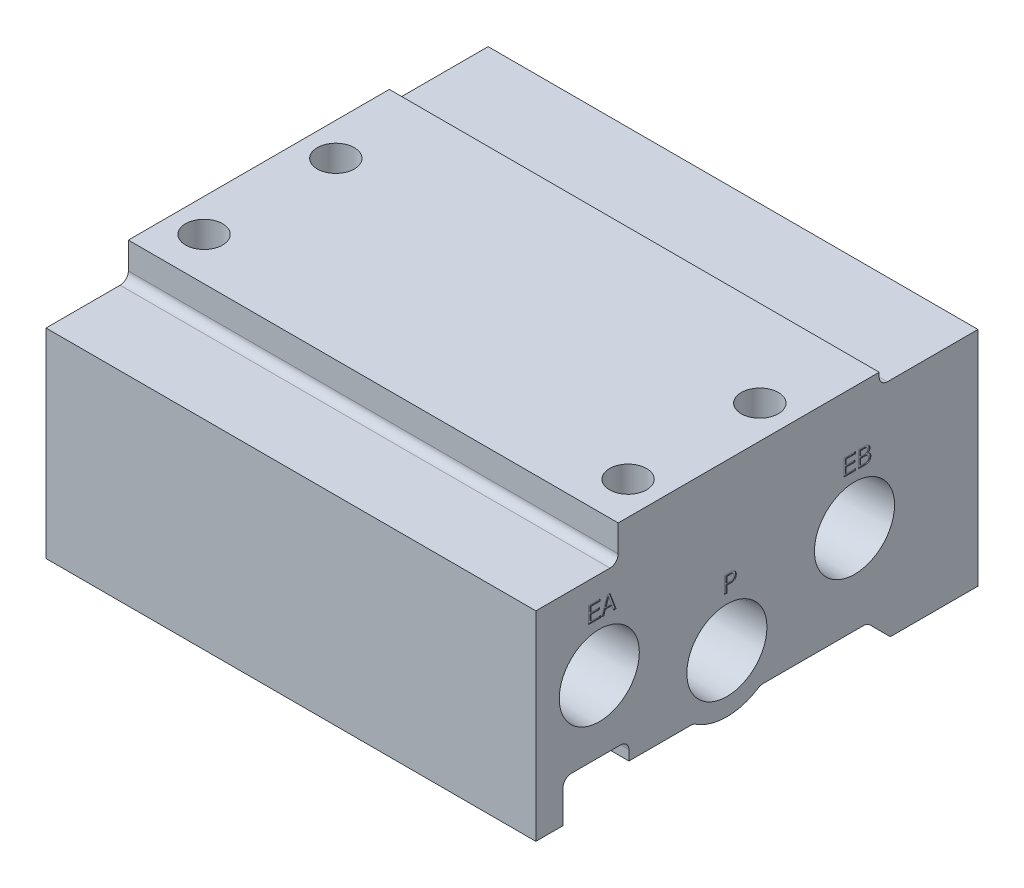
from build123d import *

# Parameters (mm, degrees)
ALUM_EXT_SKETCH_W          = 53.7
ALUM_EXT_SKETCH_H          = 28.5
ALUM_EXT_DEPTH             = 59.5
MGT_HOLES_SKETCH_R         = 2.25
MGT_HOLES_DEPTH            = 72.227961504
TOP_PROFILE_41_SKETCH_W    = 10
TOP_PROFILE_41_SKETCH_H    = 4.25
TOP_PROFILE_41_SKETCH_W_2  = 12
TOP_PROFILE_41_SKETCH_H_2  = 1.5
TOP_PROFILE_41_DEPTH       = 72.227961504
BOTTOM_PROFILE_41_DEPTH    = 72.227961504
ROUNDS_41_R                = 1
PORTS_AT_2_COUNT           = 2
PORTS_AT_2_PITCH           = 16.317475295
PORTS_AT_3_COUNT           = 2
PORTS_AT_3_PITCH           = 16.317475295
PORTS_MIRROR_AT_2_COUNT    = 2
PORTS_MIRROR_AT_2_PITCH    = 16.317475295
PORTS_MIRROR_AT_3_COUNT    = 2
PORTS_MIRROR_AT_3_PITCH    = 31
F_41_42_PORT_LABELS1_DEPTH = 0.1
F_41_42_PORT_LABELS2_DEPTH = 0.1
F_41_42_A_B_LABELS_DEPTH   = 0.1


with BuildPart() as part:
    # Alum Ext Sketch → Alum Ext (new body)
    with BuildSketch(Plane(origin=(0, 0, 0), x_dir=(0, 0, -1), z_dir=(1, 0, 0))):
        with Locations((0, -14.25)):
            Rectangle(ALUM_EXT_SKETCH_W, ALUM_EXT_SKETCH_H)
    extrude(amount=-ALUM_EXT_DEPTH)

    # MGT_Holes Sketch → MGT_Holes (cut, through all)
    with BuildSketch(Plane(origin=(0, 0, 0), x_dir=(1, 0, 0), z_dir=(0, 1, 0))):
        with Locations(Location((-55.5, 4.35, 0), (0, 0, 270))):
            Circle(MGT_HOLES_SKETCH_R)
        with Locations(Location((-55.5, -11.65, 0), (0, 0, 90))):
            Circle(MGT_HOLES_SKETCH_R)
        with Locations(Location((-4, 4.35, 0), (0, 0, 270))):
            Circle(MGT_HOLES_SKETCH_R)
        with Locations(Location((-4, -11.65, 0), (0, 0, 270))):
            Circle(MGT_HOLES_SKETCH_R)
    extrude(amount=-MGT_HOLES_DEPTH, mode=Mode.SUBTRACT)

    # Top_Profile_41 Sketch → Top_Profile_41 (cut, through all)
    with BuildSketch(Plane(origin=(0, 0, 0), x_dir=(0, 0, -1), z_dir=(1, 0, 0))):
        with Locations((-21.85, -2.125)):
            Rectangle(TOP_PROFILE_41_SKETCH_W, TOP_PROFILE_41_SKETCH_H)
        with Locations((20.85, -0.75)):
            Rectangle(TOP_PROFILE_41_SKETCH_W_2, TOP_PROFILE_41_SKETCH_H_2)
    extrude(amount=-TOP_PROFILE_41_DEPTH, mode=Mode.SUBTRACT)

    # Bottom_Profile_41 Sketch → Bottom_Profile_41 (cut, through all)
    with BuildSketch(Plane(origin=(0, 0, 0), x_dir=(0, 0, -1), z_dir=(1, 0, 0))):
        with BuildLine():
            Line((16.2, -28.5), (13.4, -25.7))
            Line((13.4, -25.7), (0.413249931, -25.7))
            ThreePointArc((0.413249931, -25.7), (-3.65, -27), (-7.713249931, -25.7))
            Line((-7.713249931, -25.7), (-15.55, -25.7))
            Line((-15.55, -25.7), (-15.55, -23.5))
            Line((-15.55, -23.5), (-23.55, -23.5))
            Line((-23.55, -23.5), (-23.55, -28.5))
            Line((-23.55, -28.5), (16.2, -28.5))
        make_face()
    extrude(amount=-BOTTOM_PROFILE_41_DEPTH, mode=Mode.SUBTRACT)

    # Rounds_41
    rounds_41_edges = [part.edges().sort_by_distance(p)[0] for p in [
        (-29.75, -4.25, 16.85),
        (-29.75, -1.5, -14.85),
        (-29.75, -25.7, -0.413249931),
        (-29.75, -23.5, 23.55),
        (-29.75, -23.5, 15.55),
        (-29.75, -25.7, 7.713249931),
        (-29.75, -25.7, -13.4),
    ]]
    fillet(rounds_41_edges, radius=ROUNDS_41_R)

    # Ports Profile Sketch → Ports (revolve, cut)
    with BuildSketch(Plane(origin=(0, -20, 3.65), x_dir=(0, 0, -1), z_dir=(0, 1, 0))):
        Polygon((0, 0), (0, 22.45), (3.95, 18.5), (3.95, 7.4), (4.632997004, 7.4), (4.864, 0), align=None)
    ports = revolve(axis=Axis((6.35, -20, 3.65), (-1, 0, 0)), mode=Mode.SUBTRACT)

    # Ports at 2: Ports ×2
    with Locations(*[Vector(0, 0.31254835125081226, -0.9499018518407041) * (i * PORTS_AT_2_PITCH) for i in range(1, PORTS_AT_2_COUNT)]):
        add(ports, mode=Mode.SUBTRACT)

    # Ports at 3: Ports ×2
    with Locations(*[Vector(0, 0.31254835125081226, 0.9499018518407041) * (i * PORTS_AT_3_PITCH) for i in range(1, PORTS_AT_3_COUNT)]):
        add(ports, mode=Mode.SUBTRACT)

    # Ports Mirror Profile Sketch → Ports Mirror (revolve, cut)
    with BuildSketch(Plane(origin=(-59.5, -14.9, -11.85), x_dir=(0, 0, 1), z_dir=(0, 1, 0))):
        Polygon((0, 0), (0, 15.885), (3.95, 11.935), (3.95, 7.4), (4.632997004, 7.4), (4.864, 0), align=None)
    ports_mirror = revolve(axis=Axis((-65.85, -14.9, -11.85), (1, 0, 0)), mode=Mode.SUBTRACT)

    # Ports Mirror at 2: Ports Mirror ×2
    with Locations(*[Vector(0, -0.31254835125081226, 0.9499018518407041) * (i * PORTS_MIRROR_AT_2_PITCH) for i in range(1, PORTS_MIRROR_AT_2_COUNT)]):
        add(ports_mirror, mode=Mode.SUBTRACT)

    # Ports Mirror at 3: Ports Mirror ×2
    with Locations(*[(0, 0, i * PORTS_MIRROR_AT_3_PITCH) for i in range(1, PORTS_MIRROR_AT_3_COUNT)]):
        add(ports_mirror, mode=Mode.SUBTRACT)

    # 41,42 Port Labels1 Sketch → 41,42 Port Labels1 (cut)
    # profile 1 of 5: a face of its own
    with BuildSketch(Plane.ZY.offset(59.5)):
        Polygon((-13.144871795, -8.9), (-13.144871795, -6.9), (-11.731410256, -6.9), (-11.731410256, -7.130769231), (-12.862820513, -7.130769231), (-12.862820513, -7.746153846), (-11.817948718, -7.746153846), (-11.817948718, -7.976923077), (-12.862820513, -7.976923077), (-12.862820513, -8.669230769), (-11.708974359, -8.669230769), (-11.708974359, -8.9), align=None)
    # profile 2 of 5: a face of its own
    with BuildSketch(Plane.ZY.offset(59.5)):
        with BuildLine():
            Line((-11.375641026, -8.9), (-11.375641026, -6.9))
            Line((-11.375641026, -6.9), (-10.582371795, -6.9))
            add(Edge.make_bspline(
                [(-10.582371795, -6.9), (-10.557520601, -6.900391088), (-10.509221677, -6.901151178), (-10.439257463, -6.906808568), (-10.373884128, -6.915794729), (-10.313491954, -6.928977632), (-10.25772712, -6.945607443), (-10.206981233, -6.966644139), (-10.160714162, -6.990826937), (-10.119486132, -7.019131964), (-10.082912178, -7.050918934), (-10.051607199, -7.087006382), (-10.024425363, -7.126312863), (-10.002795087, -7.169699096), (-9.985826511, -7.216613207), (-9.974014126, -7.267309873), (-9.966656438, -7.321659157), (-9.965816477, -7.359110147), (-9.965384615, -7.378365385)],
                knots=[0, 0, 0, 0, 1.338531614, 2.601470082, 3.778553788, 4.890456792, 5.928162005, 6.908738963, 7.84520586, 8.735147048, 9.596633689, 10.447968487, 11.301973765, 12.164180963, 13.051676454, 13.983434255, 14.963192844, 16, 16, 16, 16], degree=3))
            add(Edge.make_bspline(
                [(-9.965384615, -7.378365385), (-9.966331591, -7.402996395), (-9.968168925, -7.450785796), (-9.981718133, -7.519887959), (-10.005663085, -7.582918484), (-10.038410282, -7.640323126), (-10.080645807, -7.691469707), (-10.132507487, -7.735784439), (-10.193110711, -7.77443215), (-10.238424067, -7.793555438), (-10.261858974, -7.803445513)],
                knots=[0, 0, 0, 0, 1.064089938, 2.064560856, 3.027045975, 3.965441717, 4.908263127, 5.877849772, 6.902478258, 8, 8, 8, 8], degree=3))
            add(Edge.make_bspline(
                [(-10.261858974, -7.803445513), (-10.246569522, -7.806518626), (-10.216485798, -7.812565323), (-10.17316555, -7.826052918), (-10.132251748, -7.841956303), (-10.093880076, -7.860736947), (-10.058519403, -7.883036867), (-10.02554128, -7.907811801), (-9.995201163, -7.935720854), (-9.967752142, -7.966578157), (-9.94267115, -7.999705375), (-9.921668464, -8.035541546), (-9.903328698, -8.073092565), (-9.888526343, -8.112963113), (-9.876994446, -8.155075497), (-9.868507088, -8.199259529), (-9.863726514, -8.245513022), (-9.863126284, -8.276992465), (-9.862820513, -8.293028846)],
                knots=[0, 0, 0, 0, 1.079472139, 2.123983387, 3.137357801, 4.117691995, 5.07752268, 6.028353704, 6.970961659, 7.927265266, 8.885490285, 9.843581377, 10.799169054, 11.776706782, 12.784239396, 13.820032524, 14.889472473, 16, 16, 16, 16], degree=3))
            add(Edge.make_bspline(
                [(-9.862820513, -8.293028846), (-9.863272496, -8.315767522), (-9.864153514, -8.360090374), (-9.873541022, -8.424660596), (-9.887061044, -8.485768657), (-9.907353971, -8.543283868), (-9.933566292, -8.597000116), (-9.964872333, -8.647657469), (-10.002489133, -8.694254066), (-10.045355165, -8.737068494), (-10.093055612, -8.775646479), (-10.145401463, -8.808971319), (-10.201906819, -8.836986969), (-10.262136906, -8.860475813), (-10.326816833, -8.877901069), (-10.395416655, -8.890532564), (-10.468116052, -8.898929064), (-10.517977934, -8.899637332), (-10.543509615, -8.9)],
                knots=[0, 0, 0, 0, 1.058427598, 2.063116183, 3.033417234, 3.969927738, 4.896405358, 5.812972495, 6.737861532, 7.679194237, 8.630321786, 9.589794139, 10.563499171, 11.563941868, 12.596215416, 13.678433312, 14.811246201, 16, 16, 16, 16], degree=3))
            Line((-10.543509615, -8.9), (-11.375641026, -8.9))
        make_face()
        with BuildLine():
            Line((-11.093589744, -7.720512821), (-10.638060897, -7.720512821))
            add(Edge.make_bspline(
                [(-10.638060897, -7.720512821), (-10.62189856, -7.72024581), (-10.59060934, -7.719728896), (-10.545208349, -7.716795414), (-10.503095771, -7.710636868), (-10.464283505, -7.702711026), (-10.428663129, -7.693061693), (-10.39684222, -7.679824467), (-10.367793522, -7.665385266), (-10.342235553, -7.64779035), (-10.319629027, -7.628173795), (-10.300015633, -7.605914124), (-10.284162537, -7.580643527), (-10.270210543, -7.55333256), (-10.259923231, -7.523089629), (-10.252860224, -7.490409561), (-10.248348588, -7.45527911), (-10.247747178, -7.430997327), (-10.247435897, -7.418429487)],
                knots=[0, 0, 0, 0, 1.368886017, 2.65007316, 3.849640785, 4.969751217, 6.004381673, 6.968357812, 7.883879336, 8.746530739, 9.588092002, 10.41369514, 11.248159001, 12.107988605, 13.005734059, 13.944160956, 14.935932503, 16, 16, 16, 16], degree=3))
            add(Edge.make_bspline(
                [(-10.247435897, -7.418429487), (-10.24779526, -7.406534873), (-10.248487838, -7.383611119), (-10.252344592, -7.350275069), (-10.259615487, -7.319417291), (-10.2694704, -7.29082689), (-10.28256798, -7.264808482), (-10.298163447, -7.241021057), (-10.316774453, -7.219617856), (-10.338193209, -7.200634591), (-10.362634513, -7.184106045), (-10.389977449, -7.169577213), (-10.420615726, -7.157824898), (-10.454032304, -7.147613488), (-10.490564803, -7.140314754), (-10.529999659, -7.134572338), (-10.572575304, -7.131523238), (-10.60199904, -7.131026383), (-10.617227564, -7.130769231)],
                knots=[0, 0, 0, 0, 1.064043854, 2.05066597, 2.995108535, 3.894129092, 4.74873584, 5.593437176, 6.431611697, 7.277662936, 8.145602371, 9.064553025, 10.040417484, 11.075719197, 12.186014413, 13.368359838, 14.637970495, 16, 16, 16, 16], degree=3))
            Line((-10.617227564, -7.130769231), (-11.093589744, -7.130769231))
            Line((-11.093589744, -7.130769231), (-11.093589744, -7.720512821))
        make_face(mode=Mode.SUBTRACT)
        with BuildLine():
            Line((-11.093589744, -8.669230769), (-10.566746795, -8.669230769))
            add(Edge.make_bspline(
                [(-10.566746795, -8.669230769), (-10.549908372, -8.668922161), (-10.517373227, -8.668325869), (-10.470137599, -8.663774034), (-10.425994956, -8.656854934), (-10.385013028, -8.64634983), (-10.346971081, -8.633180858), (-10.312127837, -8.616877954), (-10.280547117, -8.597345386), (-10.251784041, -8.575352814), (-10.226609275, -8.550046268), (-10.204679995, -8.522071895), (-10.186188284, -8.49137213), (-10.170917321, -8.458069746), (-10.159316799, -8.421991925), (-10.151012013, -8.383343954), (-10.145625468, -8.342058175), (-10.145127121, -8.313612472), (-10.144871795, -8.299038462)],
                knots=[0, 0, 0, 0, 1.261340787, 2.437158505, 3.552412744, 4.605618057, 5.602418951, 6.564726798, 7.481099983, 8.379712099, 9.271165627, 10.147841252, 11.036708081, 11.950072001, 12.886651798, 13.869902527, 14.90865543, 16, 16, 16, 16], degree=3))
            add(Edge.make_bspline(
                [(-10.144871795, -8.299038462), (-10.145117446, -8.284595974), (-10.145594563, -8.256544995), (-10.151054338, -8.215943132), (-10.159140342, -8.17810658), (-10.171288059, -8.143473319), (-10.18652651, -8.111724261), (-10.205588286, -8.083183638), (-10.227647172, -8.057184402), (-10.253710324, -8.034583368), (-10.28331899, -8.01494812), (-10.31638283, -7.997503895), (-10.353598, -7.98333953), (-10.394496601, -7.971081379), (-10.439692519, -7.962804431), (-10.488439021, -7.955798704), (-10.541174333, -7.951838231), (-10.577557944, -7.951471772), (-10.596394231, -7.951282051)],
                knots=[0, 0, 0, 0, 1.058252033, 2.055394168, 2.998523969, 3.890395008, 4.739981298, 5.573732922, 6.40003374, 7.23274972, 8.093659094, 9.000297479, 9.967667442, 11.00874663, 12.12639854, 13.332554366, 14.619027337, 16, 16, 16, 16], degree=3))
            Line((-10.596394231, -7.951282051), (-11.093589744, -7.951282051))
            Line((-11.093589744, -7.951282051), (-11.093589744, -8.669230769))
        make_face(mode=Mode.SUBTRACT)
    # profile 3 of 5: a face of its own
    with BuildSketch(Plane.ZY.offset(59.5)):
        with BuildLine():
            Line((3.355128205, -14), (3.355128205, -12))
            Line((3.355128205, -12), (4.095913462, -12))
            add(Edge.make_bspline(
                [(4.095913462, -12), (4.12409362, -12.000249378), (4.177002091, -12.000717587), (4.250934098, -12.003608091), (4.314154858, -12.009200397), (4.368073681, -12.016451865), (4.415166702, -12.02754219), (4.458606554, -12.040013914), (4.499344903, -12.056098279), (4.524832794, -12.069234093), (4.537419872, -12.075721154)],
                knots=[0, 0, 0, 0, 1.493455121, 2.803973871, 3.919514338, 4.856337602, 5.683863995, 6.481055044, 7.249876038, 8, 8, 8, 8], degree=3))
            add(Edge.make_bspline(
                [(4.537419872, -12.075721154), (4.557109161, -12.087505308), (4.596238242, -12.110924292), (4.646867088, -12.157428597), (4.691435381, -12.210646113), (4.726929673, -12.2725773), (4.756116688, -12.340350372), (4.776198097, -12.414407034), (4.789029685, -12.493809121), (4.790347685, -12.548692188), (4.791025641, -12.576923077)],
                knots=[0, 0, 0, 0, 0.930560885, 1.849329941, 2.778623248, 3.742228717, 4.739438803, 5.770715934, 6.853295292, 8, 8, 8, 8], degree=3))
            add(Edge.make_bspline(
                [(4.791025641, -12.576923077), (4.790347059, -12.603953612), (4.78902587, -12.65658169), (4.776100386, -12.733053307), (4.755916476, -12.804708226), (4.727367087, -12.871331941), (4.690898401, -12.932063622), (4.64652939, -12.986531524), (4.594678687, -13.034755885), (4.555051994, -13.060899771), (4.535016026, -13.07411859)],
                knots=[0, 0, 0, 0, 1.106237948, 2.15382993, 3.166616047, 4.14912887, 5.113446575, 6.058253874, 7.018218259, 8, 8, 8, 8], degree=3))
            add(Edge.make_bspline(
                [(4.535016026, -13.07411859), (4.522597077, -13.081071894), (4.497311506, -13.095229151), (4.456117103, -13.111618603), (4.412179284, -13.125952788), (4.372704814, -13.134789239), (4.337996409, -13.140616309), (4.307779075, -13.144194947), (4.273668896, -13.146691653), (4.235640761, -13.149761537), (4.193551564, -13.151643471), (4.147467197, -13.152726574), (4.097518693, -13.153554018), (4.06292769, -13.153746548), (4.045032051, -13.153846154)],
                knots=[0, 0, 0, 0, 1.018466528, 2.073646265, 3.168741587, 4.32666575, 4.966710573, 5.68928523, 6.505122404, 7.416327688, 8.421864515, 9.522294478, 10.718160255, 12, 12, 12, 12], degree=3))
            Line((4.045032051, -13.153846154), (3.637179487, -13.153846154))
            Line((3.637179487, -13.153846154), (3.637179487, -14))
            Line((3.637179487, -14), (3.355128205, -14))
        make_face()
        with BuildLine():
            Line((3.637179487, -12.923076923), (4.087900641, -12.923076923))
            add(Edge.make_bspline(
                [(4.087900641, -12.923076923), (4.106734424, -12.922848085), (4.142970313, -12.922407806), (4.195182234, -12.919020543), (4.2428652, -12.912380011), (4.286306282, -12.90452837), (4.324991337, -12.892914993), (4.359724875, -12.880257808), (4.389709515, -12.863882812), (4.415997913, -12.84536947), (4.43829063, -12.823331396), (4.457379289, -12.798065143), (4.473409826, -12.769311124), (4.486624477, -12.737183964), (4.496532941, -12.70151272), (4.503634352, -12.662491291), (4.508057153, -12.619891899), (4.508660905, -12.590288992), (4.508974359, -12.574919872)],
                knots=[0, 0, 0, 0, 1.418142734, 2.728483292, 3.935852239, 5.042182902, 6.047730313, 6.973980857, 7.819836916, 8.612371598, 9.387426252, 10.169752478, 10.989196503, 11.859387264, 12.779284547, 13.771317079, 14.842921177, 16, 16, 16, 16], degree=3))
            add(Edge.make_bspline(
                [(4.508974359, -12.574919872), (4.508621001, -12.560087188), (4.507941592, -12.531568007), (4.504041052, -12.490281163), (4.497103925, -12.452223938), (4.486320171, -12.417522781), (4.473955018, -12.385611284), (4.457636989, -12.357322195), (4.43872536, -12.332221086), (4.416721841, -12.31008833), (4.391039013, -12.291246478), (4.361972539, -12.274585285), (4.328843401, -12.261233914), (4.292121529, -12.249962633), (4.251491521, -12.241304691), (4.207065619, -12.234912843), (4.15873708, -12.23141909), (4.125299202, -12.230991373), (4.107932692, -12.230769231)],
                knots=[0, 0, 0, 0, 1.160442503, 2.231212519, 3.241398704, 4.180061104, 5.070566702, 5.91288362, 6.725721963, 7.523583634, 8.344772017, 9.210415603, 10.137847341, 11.13257169, 12.212527806, 13.384203378, 14.64144318, 16, 16, 16, 16], degree=3))
            Line((4.107932692, -12.230769231), (3.637179487, -12.230769231))
            Line((3.637179487, -12.230769231), (3.637179487, -12.923076923))
        make_face(mode=Mode.SUBTRACT)
    # profile 4 of 5: a face of its own
    with BuildSketch(Plane.ZY.offset(59.5)):
        Polygon((17.855128205, -8.9), (17.855128205, -6.9), (19.268589744, -6.9), (19.268589744, -7.130769231), (18.137179487, -7.130769231), (18.137179487, -7.746153846), (19.182051282, -7.746153846), (19.182051282, -7.976923077), (18.137179487, -7.976923077), (18.137179487, -8.669230769), (19.291025641, -8.669230769), (19.291025641, -8.9), align=None)
    # profile 5 of 5: a face of its own
    with BuildSketch(Plane.ZY.offset(59.5)):
        Polygon((19.419230769, -8.9), (20.149198718, -6.9), (20.447676282, -6.9), (21.188461538, -8.9), (20.895592949, -8.9), (20.68525641, -8.31025641), (19.902403846, -8.31025641), (19.690464744, -8.9), align=None)
        Polygon((19.986137821, -8.079487179), (20.605528846, -8.079487179), (20.297836538, -7.188862179), align=None, mode=Mode.SUBTRACT)
    extrude(amount=-F_41_42_PORT_LABELS1_DEPTH, mode=Mode.SUBTRACT)

    # 41,42 Port Labels2 Sketch → 41,42 Port Labels2 (cut)
    # profile 1 of 5: a face of its own
    with BuildSketch(Plane(origin=(0, 0, 0), x_dir=(0, 0, -1), z_dir=(1, 0, 0))):
        Polygon((-20.444871795, -8.9), (-20.444871795, -6.9), (-19.031410256, -6.9), (-19.031410256, -7.130769231), (-20.162820513, -7.130769231), (-20.162820513, -7.746153846), (-19.117948718, -7.746153846), (-19.117948718, -7.976923077), (-20.162820513, -7.976923077), (-20.162820513, -8.669230769), (-19.008974359, -8.669230769), (-19.008974359, -8.9), align=None)
    # profile 2 of 5: a face of its own
    with BuildSketch(Plane(origin=(0, 0, 0), x_dir=(0, 0, -1), z_dir=(1, 0, 0))):
        Polygon((-18.880769231, -8.9), (-18.150801282, -6.9), (-17.852323718, -6.9), (-17.111538462, -8.9), (-17.404407051, -8.9), (-17.61474359, -8.31025641), (-18.397596154, -8.31025641), (-18.609535256, -8.9), align=None)
        Polygon((-18.313862179, -8.079487179), (-17.694471154, -8.079487179), (-18.002163462, -7.188862179), align=None, mode=Mode.SUBTRACT)
    # profile 3 of 5: a face of its own
    with BuildSketch(Plane(origin=(0, 0, 0), x_dir=(0, 0, -1), z_dir=(1, 0, 0))):
        with BuildLine():
            Line((-3.944871795, -14), (-3.944871795, -12))
            Line((-3.944871795, -12), (-3.204086538, -12))
            add(Edge.make_bspline(
                [(-3.204086538, -12), (-3.17590638, -12.000249378), (-3.122997909, -12.000717587), (-3.049065902, -12.003608091), (-2.985845142, -12.009200397), (-2.931926319, -12.016451865), (-2.884833298, -12.02754219), (-2.841393446, -12.040013914), (-2.800655097, -12.056098279), (-2.775167206, -12.069234093), (-2.762580128, -12.075721154)],
                knots=[0, 0, 0, 0, 1.493455121, 2.803973871, 3.919514338, 4.856337602, 5.683863995, 6.481055044, 7.249876038, 8, 8, 8, 8], degree=3))
            add(Edge.make_bspline(
                [(-2.762580128, -12.075721154), (-2.742890839, -12.087505308), (-2.703761758, -12.110924292), (-2.653132912, -12.157428597), (-2.608564619, -12.210646113), (-2.573070327, -12.2725773), (-2.543883312, -12.340350372), (-2.523801903, -12.414407034), (-2.510970315, -12.493809121), (-2.509652315, -12.548692188), (-2.508974359, -12.576923077)],
                knots=[0, 0, 0, 0, 0.930560885, 1.849329941, 2.778623248, 3.742228717, 4.739438803, 5.770715934, 6.853295292, 8, 8, 8, 8], degree=3))
            add(Edge.make_bspline(
                [(-2.508974359, -12.576923077), (-2.509652941, -12.603953612), (-2.51097413, -12.65658169), (-2.523899614, -12.733053307), (-2.544083524, -12.804708226), (-2.572632913, -12.871331941), (-2.609101599, -12.932063622), (-2.65347061, -12.986531524), (-2.705321313, -13.034755885), (-2.744948006, -13.060899771), (-2.764983974, -13.07411859)],
                knots=[0, 0, 0, 0, 1.106237948, 2.15382993, 3.166616047, 4.14912887, 5.113446575, 6.058253874, 7.018218259, 8, 8, 8, 8], degree=3))
            add(Edge.make_bspline(
                [(-2.764983974, -13.07411859), (-2.777402923, -13.081071894), (-2.802688494, -13.095229151), (-2.843882897, -13.111618603), (-2.887820716, -13.125952788), (-2.927295186, -13.134789239), (-2.962003591, -13.140616309), (-2.992220925, -13.144194947), (-3.026331104, -13.146691653), (-3.064359239, -13.149761537), (-3.106448436, -13.151643471), (-3.152532803, -13.152726574), (-3.202481307, -13.153554018), (-3.23707231, -13.153746548), (-3.254967949, -13.153846154)],
                knots=[0, 0, 0, 0, 1.018466528, 2.073646265, 3.168741587, 4.32666575, 4.966710573, 5.68928523, 6.505122404, 7.416327688, 8.421864515, 9.522294478, 10.718160255, 12, 12, 12, 12], degree=3))
            Line((-3.254967949, -13.153846154), (-3.662820513, -13.153846154))
            Line((-3.662820513, -13.153846154), (-3.662820513, -14))
            Line((-3.662820513, -14), (-3.944871795, -14))
        make_face()
        with BuildLine():
            Line((-3.662820513, -12.923076923), (-3.212099359, -12.923076923))
            add(Edge.make_bspline(
                [(-3.212099359, -12.923076923), (-3.193265576, -12.922848085), (-3.157029687, -12.922407806), (-3.104817766, -12.919020543), (-3.0571348, -12.912380011), (-3.013693718, -12.90452837), (-2.975008663, -12.892914993), (-2.940275125, -12.880257808), (-2.910290485, -12.863882812), (-2.884002087, -12.84536947), (-2.86170937, -12.823331396), (-2.842620711, -12.798065143), (-2.826590174, -12.769311124), (-2.813375523, -12.737183964), (-2.803467059, -12.70151272), (-2.796365648, -12.662491291), (-2.791942847, -12.619891899), (-2.791339095, -12.590288992), (-2.791025641, -12.574919872)],
                knots=[0, 0, 0, 0, 1.418142734, 2.728483292, 3.935852239, 5.042182902, 6.047730313, 6.973980857, 7.819836916, 8.612371598, 9.387426252, 10.169752478, 10.989196503, 11.859387264, 12.779284547, 13.771317079, 14.842921177, 16, 16, 16, 16], degree=3))
            add(Edge.make_bspline(
                [(-2.791025641, -12.574919872), (-2.791378999, -12.560087188), (-2.792058408, -12.531568007), (-2.795958948, -12.490281163), (-2.802896075, -12.452223938), (-2.813679829, -12.417522781), (-2.826044982, -12.385611284), (-2.842363011, -12.357322195), (-2.86127464, -12.332221086), (-2.883278159, -12.31008833), (-2.908960987, -12.291246478), (-2.938027461, -12.274585285), (-2.971156599, -12.261233914), (-3.007878471, -12.249962633), (-3.048508479, -12.241304691), (-3.092934381, -12.234912843), (-3.14126292, -12.23141909), (-3.174700798, -12.230991373), (-3.192067308, -12.230769231)],
                knots=[0, 0, 0, 0, 1.160442503, 2.231212519, 3.241398704, 4.180061104, 5.070566702, 5.91288362, 6.725721963, 7.523583634, 8.344772017, 9.210415603, 10.137847341, 11.13257169, 12.212527806, 13.384203378, 14.64144318, 16, 16, 16, 16], degree=3))
            Line((-3.192067308, -12.230769231), (-3.662820513, -12.230769231))
            Line((-3.662820513, -12.230769231), (-3.662820513, -12.923076923))
        make_face(mode=Mode.SUBTRACT)
    # profile 4 of 5: a face of its own
    with BuildSketch(Plane(origin=(0, 0, 0), x_dir=(0, 0, -1), z_dir=(1, 0, 0))):
        Polygon((10.555128205, -8.9), (10.555128205, -6.9), (11.968589744, -6.9), (11.968589744, -7.130769231), (10.837179487, -7.130769231), (10.837179487, -7.746153846), (11.882051282, -7.746153846), (11.882051282, -7.976923077), (10.837179487, -7.976923077), (10.837179487, -8.669230769), (11.991025641, -8.669230769), (11.991025641, -8.9), align=None)
    # profile 5 of 5: a face of its own
    with BuildSketch(Plane(origin=(0, 0, 0), x_dir=(0, 0, -1), z_dir=(1, 0, 0))):
        with BuildLine():
            Line((12.324358974, -8.9), (12.324358974, -6.9))
            Line((12.324358974, -6.9), (13.117628205, -6.9))
            add(Edge.make_bspline(
                [(13.117628205, -6.9), (13.142479399, -6.900391088), (13.190778323, -6.901151178), (13.260742537, -6.906808568), (13.326115872, -6.915794729), (13.386508046, -6.928977632), (13.44227288, -6.945607443), (13.493018767, -6.966644139), (13.539285838, -6.990826937), (13.580513868, -7.019131964), (13.617087822, -7.050918934), (13.648392801, -7.087006382), (13.675574637, -7.126312863), (13.697204913, -7.169699096), (13.714173489, -7.216613207), (13.725985874, -7.267309873), (13.733343562, -7.321659157), (13.734183523, -7.359110147), (13.734615385, -7.378365385)],
                knots=[0, 0, 0, 0, 1.338531614, 2.601470082, 3.778553788, 4.890456792, 5.928162005, 6.908738963, 7.84520586, 8.735147048, 9.596633689, 10.447968487, 11.301973765, 12.164180963, 13.051676454, 13.983434255, 14.963192844, 16, 16, 16, 16], degree=3))
            add(Edge.make_bspline(
                [(13.734615385, -7.378365385), (13.733668409, -7.402996395), (13.731831075, -7.450785796), (13.718281867, -7.519887959), (13.694336915, -7.582918484), (13.661589718, -7.640323126), (13.619354193, -7.691469707), (13.567492513, -7.735784439), (13.506889289, -7.77443215), (13.461575933, -7.793555438), (13.438141026, -7.803445513)],
                knots=[0, 0, 0, 0, 1.064089938, 2.064560856, 3.027045975, 3.965441717, 4.908263127, 5.877849772, 6.902478258, 8, 8, 8, 8], degree=3))
            add(Edge.make_bspline(
                [(13.438141026, -7.803445513), (13.453430478, -7.806518626), (13.483514202, -7.812565323), (13.52683445, -7.826052918), (13.567748252, -7.841956303), (13.606119924, -7.860736947), (13.641480597, -7.883036867), (13.67445872, -7.907811801), (13.704798837, -7.935720854), (13.732247858, -7.966578157), (13.75732885, -7.999705375), (13.778331536, -8.035541546), (13.796671302, -8.073092565), (13.811473657, -8.112963113), (13.823005554, -8.155075497), (13.831492912, -8.199259529), (13.836273486, -8.245513022), (13.836873716, -8.276992465), (13.837179487, -8.293028846)],
                knots=[0, 0, 0, 0, 1.079472139, 2.123983387, 3.137357801, 4.117691995, 5.07752268, 6.028353704, 6.970961659, 7.927265266, 8.885490285, 9.843581377, 10.799169054, 11.776706782, 12.784239396, 13.820032524, 14.889472473, 16, 16, 16, 16], degree=3))
            add(Edge.make_bspline(
                [(13.837179487, -8.293028846), (13.836727504, -8.315767522), (13.835846486, -8.360090374), (13.826458978, -8.424660596), (13.812938956, -8.485768657), (13.792646029, -8.543283868), (13.766433708, -8.597000116), (13.735127667, -8.647657469), (13.697510867, -8.694254066), (13.654644835, -8.737068494), (13.606944388, -8.775646479), (13.554598537, -8.808971319), (13.498093181, -8.836986969), (13.437863094, -8.860475813), (13.373183167, -8.877901069), (13.304583345, -8.890532564), (13.231883948, -8.898929064), (13.182022066, -8.899637332), (13.156490385, -8.9)],
                knots=[0, 0, 0, 0, 1.058427598, 2.063116183, 3.033417234, 3.969927738, 4.896405358, 5.812972495, 6.737861532, 7.679194237, 8.630321786, 9.589794139, 10.563499171, 11.563941868, 12.596215416, 13.678433312, 14.811246201, 16, 16, 16, 16], degree=3))
            Line((13.156490385, -8.9), (12.324358974, -8.9))
        make_face()
        with BuildLine():
            Line((12.606410256, -7.720512821), (13.061939103, -7.720512821))
            add(Edge.make_bspline(
                [(13.061939103, -7.720512821), (13.07810144, -7.72024581), (13.10939066, -7.719728896), (13.154791651, -7.716795414), (13.196904229, -7.710636868), (13.235716495, -7.702711026), (13.271336871, -7.693061693), (13.30315778, -7.679824467), (13.332206478, -7.665385266), (13.357764447, -7.64779035), (13.380370973, -7.628173795), (13.399984367, -7.605914124), (13.415837463, -7.580643527), (13.429789457, -7.55333256), (13.440076769, -7.523089629), (13.447139776, -7.490409561), (13.451651412, -7.45527911), (13.452252822, -7.430997327), (13.452564103, -7.418429487)],
                knots=[0, 0, 0, 0, 1.368886017, 2.65007316, 3.849640785, 4.969751217, 6.004381673, 6.968357812, 7.883879336, 8.746530739, 9.588092002, 10.41369514, 11.248159001, 12.107988605, 13.005734059, 13.944160956, 14.935932503, 16, 16, 16, 16], degree=3))
            add(Edge.make_bspline(
                [(13.452564103, -7.418429487), (13.45220474, -7.406534873), (13.451512162, -7.383611119), (13.447655408, -7.350275069), (13.440384513, -7.319417291), (13.4305296, -7.29082689), (13.41743202, -7.264808482), (13.401836553, -7.241021057), (13.383225547, -7.219617856), (13.361806791, -7.200634591), (13.337365487, -7.184106045), (13.310022551, -7.169577213), (13.279384274, -7.157824898), (13.245967696, -7.147613488), (13.209435197, -7.140314754), (13.170000341, -7.134572338), (13.127424696, -7.131523238), (13.09800096, -7.131026383), (13.082772436, -7.130769231)],
                knots=[0, 0, 0, 0, 1.064043854, 2.05066597, 2.995108535, 3.894129092, 4.74873584, 5.593437176, 6.431611697, 7.277662936, 8.145602371, 9.064553025, 10.040417484, 11.075719197, 12.186014413, 13.368359838, 14.637970495, 16, 16, 16, 16], degree=3))
            Line((13.082772436, -7.130769231), (12.606410256, -7.130769231))
            Line((12.606410256, -7.130769231), (12.606410256, -7.720512821))
        make_face(mode=Mode.SUBTRACT)
        with BuildLine():
            Line((12.606410256, -8.669230769), (13.133253205, -8.669230769))
            add(Edge.make_bspline(
                [(13.133253205, -8.669230769), (13.150091628, -8.668922161), (13.182626773, -8.668325869), (13.229862401, -8.663774034), (13.274005044, -8.656854934), (13.314986972, -8.64634983), (13.353028919, -8.633180858), (13.387872163, -8.616877954), (13.419452883, -8.597345386), (13.448215959, -8.575352814), (13.473390725, -8.550046268), (13.495320005, -8.522071895), (13.513811716, -8.49137213), (13.529082679, -8.458069746), (13.540683201, -8.421991925), (13.548987987, -8.383343954), (13.554374532, -8.342058175), (13.554872879, -8.313612472), (13.555128205, -8.299038462)],
                knots=[0, 0, 0, 0, 1.261340787, 2.437158505, 3.552412744, 4.605618057, 5.602418951, 6.564726798, 7.481099983, 8.379712099, 9.271165627, 10.147841252, 11.036708081, 11.950072001, 12.886651798, 13.869902527, 14.90865543, 16, 16, 16, 16], degree=3))
            add(Edge.make_bspline(
                [(13.555128205, -8.299038462), (13.554882554, -8.284595974), (13.554405437, -8.256544995), (13.548945662, -8.215943132), (13.540859658, -8.17810658), (13.528711941, -8.143473319), (13.51347349, -8.111724261), (13.494411714, -8.083183638), (13.472352828, -8.057184402), (13.446289676, -8.034583368), (13.41668101, -8.01494812), (13.38361717, -7.997503895), (13.346402, -7.98333953), (13.305503399, -7.971081379), (13.260307481, -7.962804431), (13.211560979, -7.955798704), (13.158825667, -7.951838231), (13.122442056, -7.951471772), (13.103605769, -7.951282051)],
                knots=[0, 0, 0, 0, 1.058252033, 2.055394168, 2.998523969, 3.890395008, 4.739981298, 5.573732922, 6.40003374, 7.23274972, 8.093659094, 9.000297479, 9.967667442, 11.00874663, 12.12639854, 13.332554366, 14.619027337, 16, 16, 16, 16], degree=3))
            Line((13.103605769, -7.951282051), (12.606410256, -7.951282051))
            Line((12.606410256, -7.951282051), (12.606410256, -8.669230769))
        make_face(mode=Mode.SUBTRACT)
    extrude(amount=-F_41_42_PORT_LABELS2_DEPTH, mode=Mode.SUBTRACT)

    # 41,42 A,B Labels Sketch → 41,42 A,B Labels (cut)
    # profile 1 of 4: a face of its own
    with BuildSketch(Plane.XY.offset(-26.85)):
        Polygon((-55, -10), (-56.27744391, -6.5), (-56.799779647, -6.5), (-58.096153846, -10), (-57.583633814, -10), (-57.215544872, -8.967948718), (-55.845552885, -8.967948718), (-55.474659455, -10), align=None)
        Polygon((-55.99208734, -8.564102564), (-57.076021635, -8.564102564), (-56.537560096, -7.005508814), align=None, mode=Mode.SUBTRACT)
    # profile 2 of 4: a face of its own
    with BuildSketch(Plane.XY.offset(-26.85)):
        with BuildLine():
            Line((-48.858974359, -23.5), (-48.858974359, -20))
            Line((-48.858974359, -20), (-50.247195513, -20))
            add(Edge.make_bspline(
                [(-50.247195513, -20), (-50.290685102, -20.000684404), (-50.375208219, -20.002014561), (-50.497645593, -20.011914994), (-50.61204893, -20.027640776), (-50.717735234, -20.050710856), (-50.815323694, -20.079813026), (-50.904128997, -20.116627242), (-50.985096371, -20.158947141), (-51.057245422, -20.208480936), (-51.121249843, -20.264108134), (-51.176033556, -20.327261168), (-51.223601769, -20.396047509), (-51.261454752, -20.471973419), (-51.29114976, -20.554073113), (-51.311821433, -20.642792277), (-51.324697388, -20.737903525), (-51.326167319, -20.803442756), (-51.326923077, -20.837139423)],
                knots=[0, 0, 0, 0, 1.338531614, 2.601470082, 3.778553788, 4.890456792, 5.928162005, 6.908738963, 7.84520586, 8.735147048, 9.596633689, 10.447968487, 11.301973765, 12.164180963, 13.051676454, 13.983434255, 14.963192844, 16, 16, 16, 16], degree=3))
            add(Edge.make_bspline(
                [(-51.326923077, -20.837139423), (-51.32526587, -20.880243692), (-51.322050535, -20.963875144), (-51.29833942, -21.084803928), (-51.256435755, -21.195107347), (-51.199128161, -21.295565471), (-51.125215992, -21.385071987), (-51.034458052, -21.462622768), (-50.928402409, -21.530256263), (-50.849104036, -21.563722017), (-50.808092949, -21.581029647)],
                knots=[0, 0, 0, 0, 1.064089938, 2.064560856, 3.027045975, 3.965441717, 4.908263127, 5.877849772, 6.902478258, 8, 8, 8, 8], degree=3))
            add(Edge.make_bspline(
                [(-50.808092949, -21.581029647), (-50.83484949, -21.586407596), (-50.887496008, -21.596989316), (-50.963306442, -21.620592607), (-51.034905595, -21.648423531), (-51.102056021, -21.681289657), (-51.163937199, -21.720314518), (-51.221648914, -21.763670652), (-51.274744119, -21.812511494), (-51.322779905, -21.866511775), (-51.366671641, -21.924484406), (-51.403426342, -21.987197706), (-51.435520932, -22.052911989), (-51.461425053, -22.122685447), (-51.481605873, -22.196382119), (-51.49645875, -22.273704176), (-51.504824755, -22.354647789), (-51.505875157, -22.409736815), (-51.506410256, -22.437800481)],
                knots=[0, 0, 0, 0, 1.079472139, 2.123983387, 3.137357801, 4.117691995, 5.07752268, 6.028353704, 6.970961659, 7.927265266, 8.885490285, 9.843581377, 10.799169054, 11.776706782, 12.784239396, 13.820032524, 14.889472473, 16, 16, 16, 16], degree=3))
            add(Edge.make_bspline(
                [(-51.506410256, -22.437800481), (-51.505619286, -22.477593164), (-51.504077505, -22.555158155), (-51.487649365, -22.668156042), (-51.463989327, -22.77509515), (-51.428476704, -22.875746769), (-51.382605143, -22.969750203), (-51.327819571, -23.058400571), (-51.261990171, -23.139944616), (-51.186974614, -23.214869865), (-51.103498834, -23.282381338), (-51.011893594, -23.340699808), (-50.91300922, -23.389727196), (-50.807606568, -23.430832673), (-50.694416695, -23.461326871), (-50.574367008, -23.483431987), (-50.447143063, -23.498125862), (-50.35988477, -23.499365332), (-50.315204327, -23.5)],
                knots=[0, 0, 0, 0, 1.058427598, 2.063116183, 3.033417234, 3.969927738, 4.896405358, 5.812972495, 6.737861532, 7.679194237, 8.630321786, 9.589794139, 10.563499171, 11.563941868, 12.596215416, 13.678433312, 14.811246201, 16, 16, 16, 16], degree=3))
            Line((-50.315204327, -23.5), (-48.858974359, -23.5))
        make_face()
        with BuildLine():
            Line((-49.352564103, -21.435897436), (-50.149739583, -21.435897436))
            add(Edge.make_bspline(
                [(-50.149739583, -21.435897436), (-50.178023674, -21.435430168), (-50.23277981, -21.434525568), (-50.312231542, -21.429391974), (-50.385928555, -21.418614519), (-50.453850021, -21.404744295), (-50.516185678, -21.387857963), (-50.571872268, -21.364692817), (-50.62270749, -21.339424215), (-50.667433937, -21.308633112), (-50.706995357, -21.274304141), (-50.741318795, -21.235349716), (-50.769061713, -21.191126172), (-50.793477703, -21.143331981), (-50.8114805, -21.09040685), (-50.823840762, -21.033216732), (-50.831736124, -20.971738443), (-50.832788593, -20.929245323), (-50.833333333, -20.907251603)],
                knots=[0, 0, 0, 0, 1.368886017, 2.65007316, 3.849640785, 4.969751217, 6.004381673, 6.968357812, 7.883879336, 8.746530739, 9.588092002, 10.41369514, 11.248159001, 12.107988605, 13.005734059, 13.944160956, 14.935932503, 16, 16, 16, 16], degree=3))
            add(Edge.make_bspline(
                [(-50.833333333, -20.907251603), (-50.832704448, -20.886436029), (-50.831492437, -20.846319459), (-50.824743118, -20.78798137), (-50.812019051, -20.733980259), (-50.794772954, -20.683947058), (-50.771852189, -20.638414843), (-50.744560122, -20.59678685), (-50.711990861, -20.559331249), (-50.674508037, -20.526110534), (-50.631735756, -20.497185578), (-50.583885618, -20.471760122), (-50.530268633, -20.451193571), (-50.471789621, -20.433323604), (-50.407857749, -20.42055082), (-50.33884675, -20.410501592), (-50.264339373, -20.405165666), (-50.212847835, -20.40429617), (-50.186197917, -20.403846154)],
                knots=[0, 0, 0, 0, 1.064043854, 2.05066597, 2.995108535, 3.894129092, 4.74873584, 5.593437176, 6.431611697, 7.277662936, 8.145602371, 9.064553025, 10.040417484, 11.075719197, 12.186014413, 13.368359838, 14.637970495, 16, 16, 16, 16], degree=3))
            Line((-50.186197917, -20.403846154), (-49.352564103, -20.403846154))
            Line((-49.352564103, -20.403846154), (-49.352564103, -21.435897436))
        make_face(mode=Mode.SUBTRACT)
        with BuildLine():
            Line((-49.352564103, -23.096153846), (-50.274539263, -23.096153846))
            add(Edge.make_bspline(
                [(-50.274539263, -23.096153846), (-50.304006503, -23.095613782), (-50.360943007, -23.094570271), (-50.443605356, -23.086604559), (-50.520854981, -23.074496135), (-50.592573355, -23.056112202), (-50.659146761, -23.033066501), (-50.720122439, -23.004536419), (-50.775388699, -22.970354426), (-50.825724082, -22.931867424), (-50.869779923, -22.88758097), (-50.908156162, -22.838625817), (-50.940516657, -22.784901228), (-50.967240842, -22.726622055), (-50.987541756, -22.663485868), (-51.002075131, -22.595851919), (-51.011501585, -22.523601806), (-51.012373693, -22.473821826), (-51.012820513, -22.448317308)],
                knots=[0, 0, 0, 0, 1.261340787, 2.437158505, 3.552412744, 4.605618057, 5.602418951, 6.564726798, 7.481099983, 8.379712099, 9.271165627, 10.147841252, 11.036708081, 11.950072001, 12.886651798, 13.869902527, 14.90865543, 16, 16, 16, 16], degree=3))
            add(Edge.make_bspline(
                [(-51.012820513, -22.448317308), (-51.012390624, -22.423042954), (-51.011555669, -22.373953741), (-51.002001063, -22.30290048), (-50.987850556, -22.236686515), (-50.966592051, -22.176078308), (-50.939924762, -22.120517457), (-50.906566653, -22.070571367), (-50.867963603, -22.025072704), (-50.822353087, -21.985520894), (-50.770537921, -21.95115921), (-50.712676202, -21.920631816), (-50.647549654, -21.895844178), (-50.575977103, -21.874392413), (-50.496884246, -21.859907754), (-50.411577868, -21.847647732), (-50.319291071, -21.840716904), (-50.255619752, -21.840075601), (-50.22265625, -21.83974359)],
                knots=[0, 0, 0, 0, 1.058252033, 2.055394168, 2.998523969, 3.890395008, 4.739981298, 5.573732922, 6.40003374, 7.23274972, 8.093659094, 9.000297479, 9.967667442, 11.00874663, 12.12639854, 13.332554366, 14.619027337, 16, 16, 16, 16], degree=3))
            Line((-50.22265625, -21.83974359), (-49.352564103, -21.83974359))
            Line((-49.352564103, -21.83974359), (-49.352564103, -23.096153846))
        make_face(mode=Mode.SUBTRACT)
    # profile 3 of 4: a face of its own
    with BuildSketch(Plane.XY.offset(-26.85)):
        Polygon((-8, -10), (-9.27744391, -6.5), (-9.799779647, -6.5), (-11.096153846, -10), (-10.583633814, -10), (-10.215544872, -8.967948718), (-8.845552885, -8.967948718), (-8.474659455, -10), align=None)
        Polygon((-8.99208734, -8.564102564), (-10.076021635, -8.564102564), (-9.537560096, -7.005508814), align=None, mode=Mode.SUBTRACT)
    # profile 4 of 4: a face of its own
    with BuildSketch(Plane.XY.offset(-26.85)):
        with BuildLine():
            Line((-1.358974359, -23.5), (-1.358974359, -20))
            Line((-1.358974359, -20), (-2.747195513, -20))
            add(Edge.make_bspline(
                [(-2.747195513, -20), (-2.790685102, -20.000684404), (-2.875208219, -20.002014561), (-2.997645593, -20.011914994), (-3.11204893, -20.027640776), (-3.217735234, -20.050710856), (-3.315323694, -20.079813026), (-3.404128997, -20.116627242), (-3.485096371, -20.158947141), (-3.557245422, -20.208480936), (-3.621249843, -20.264108134), (-3.676033556, -20.327261168), (-3.723601769, -20.396047509), (-3.761454752, -20.471973419), (-3.79114976, -20.554073113), (-3.811821433, -20.642792277), (-3.824697388, -20.737903525), (-3.826167319, -20.803442756), (-3.826923077, -20.837139423)],
                knots=[0, 0, 0, 0, 1.338531614, 2.601470082, 3.778553788, 4.890456792, 5.928162005, 6.908738963, 7.84520586, 8.735147048, 9.596633689, 10.447968487, 11.301973765, 12.164180963, 13.051676454, 13.983434255, 14.963192844, 16, 16, 16, 16], degree=3))
            add(Edge.make_bspline(
                [(-3.826923077, -20.837139423), (-3.82526587, -20.880243692), (-3.822050535, -20.963875144), (-3.79833942, -21.084803928), (-3.756435755, -21.195107347), (-3.699128161, -21.295565471), (-3.625215992, -21.385071987), (-3.534458052, -21.462622768), (-3.428402409, -21.530256263), (-3.349104036, -21.563722017), (-3.308092949, -21.581029647)],
                knots=[0, 0, 0, 0, 1.064089938, 2.064560856, 3.027045975, 3.965441717, 4.908263127, 5.877849772, 6.902478258, 8, 8, 8, 8], degree=3))
            add(Edge.make_bspline(
                [(-3.308092949, -21.581029647), (-3.33484949, -21.586407596), (-3.387496008, -21.596989316), (-3.463306442, -21.620592607), (-3.534905595, -21.648423531), (-3.602056021, -21.681289657), (-3.663937199, -21.720314518), (-3.721648914, -21.763670652), (-3.774744119, -21.812511494), (-3.822779905, -21.866511775), (-3.866671641, -21.924484406), (-3.903426342, -21.987197706), (-3.935520932, -22.052911989), (-3.961425053, -22.122685447), (-3.981605873, -22.196382119), (-3.99645875, -22.273704176), (-4.004824755, -22.354647789), (-4.005875157, -22.409736815), (-4.006410256, -22.437800481)],
                knots=[0, 0, 0, 0, 1.079472139, 2.123983387, 3.137357801, 4.117691995, 5.07752268, 6.028353704, 6.970961659, 7.927265266, 8.885490285, 9.843581377, 10.799169054, 11.776706782, 12.784239396, 13.820032524, 14.889472473, 16, 16, 16, 16], degree=3))
            add(Edge.make_bspline(
                [(-4.006410256, -22.437800481), (-4.005619286, -22.477593164), (-4.004077505, -22.555158155), (-3.987649365, -22.668156042), (-3.963989327, -22.77509515), (-3.928476704, -22.875746769), (-3.882605143, -22.969750203), (-3.827819571, -23.058400571), (-3.761990171, -23.139944616), (-3.686974614, -23.214869865), (-3.603498834, -23.282381338), (-3.511893594, -23.340699808), (-3.41300922, -23.389727196), (-3.307606568, -23.430832673), (-3.194416695, -23.461326871), (-3.074367008, -23.483431987), (-2.947143063, -23.498125862), (-2.85988477, -23.499365332), (-2.815204327, -23.5)],
                knots=[0, 0, 0, 0, 1.058427598, 2.063116183, 3.033417234, 3.969927738, 4.896405358, 5.812972495, 6.737861532, 7.679194237, 8.630321786, 9.589794139, 10.563499171, 11.563941868, 12.596215416, 13.678433312, 14.811246201, 16, 16, 16, 16], degree=3))
            Line((-2.815204327, -23.5), (-1.358974359, -23.5))
        make_face()
        with BuildLine():
            Line((-1.852564103, -21.435897436), (-2.649739583, -21.435897436))
            add(Edge.make_bspline(
                [(-2.649739583, -21.435897436), (-2.678023674, -21.435430168), (-2.73277981, -21.434525568), (-2.812231542, -21.429391974), (-2.885928555, -21.418614519), (-2.953850021, -21.404744295), (-3.016185678, -21.387857963), (-3.071872268, -21.364692817), (-3.12270749, -21.339424215), (-3.167433937, -21.308633112), (-3.206995357, -21.274304141), (-3.241318795, -21.235349716), (-3.269061713, -21.191126172), (-3.293477703, -21.143331981), (-3.3114805, -21.09040685), (-3.323840762, -21.033216732), (-3.331736124, -20.971738443), (-3.332788593, -20.929245323), (-3.333333333, -20.907251603)],
                knots=[0, 0, 0, 0, 1.368886017, 2.65007316, 3.849640785, 4.969751217, 6.004381673, 6.968357812, 7.883879336, 8.746530739, 9.588092002, 10.41369514, 11.248159001, 12.107988605, 13.005734059, 13.944160956, 14.935932503, 16, 16, 16, 16], degree=3))
            add(Edge.make_bspline(
                [(-3.333333333, -20.907251603), (-3.332704448, -20.886436029), (-3.331492437, -20.846319459), (-3.324743118, -20.78798137), (-3.312019051, -20.733980259), (-3.294772954, -20.683947058), (-3.271852189, -20.638414843), (-3.244560122, -20.59678685), (-3.211990861, -20.559331249), (-3.174508037, -20.526110534), (-3.131735756, -20.497185578), (-3.083885618, -20.471760122), (-3.030268633, -20.451193571), (-2.971789621, -20.433323604), (-2.907857749, -20.42055082), (-2.83884675, -20.410501592), (-2.764339373, -20.405165666), (-2.712847835, -20.40429617), (-2.686197917, -20.403846154)],
                knots=[0, 0, 0, 0, 1.064043854, 2.05066597, 2.995108535, 3.894129092, 4.74873584, 5.593437176, 6.431611697, 7.277662936, 8.145602371, 9.064553025, 10.040417484, 11.075719197, 12.186014413, 13.368359838, 14.637970495, 16, 16, 16, 16], degree=3))
            Line((-2.686197917, -20.403846154), (-1.852564103, -20.403846154))
            Line((-1.852564103, -20.403846154), (-1.852564103, -21.435897436))
        make_face(mode=Mode.SUBTRACT)
        with BuildLine():
            Line((-1.852564103, -23.096153846), (-2.774539263, -23.096153846))
            add(Edge.make_bspline(
                [(-2.774539263, -23.096153846), (-2.804006503, -23.095613782), (-2.860943007, -23.094570271), (-2.943605356, -23.086604559), (-3.020854981, -23.074496135), (-3.092573355, -23.056112202), (-3.159146761, -23.033066501), (-3.220122439, -23.004536419), (-3.275388699, -22.970354426), (-3.325724082, -22.931867424), (-3.369779923, -22.88758097), (-3.408156162, -22.838625817), (-3.440516657, -22.784901228), (-3.467240842, -22.726622055), (-3.487541756, -22.663485868), (-3.502075131, -22.595851919), (-3.511501585, -22.523601806), (-3.512373693, -22.473821826), (-3.512820513, -22.448317308)],
                knots=[0, 0, 0, 0, 1.261340787, 2.437158505, 3.552412744, 4.605618057, 5.602418951, 6.564726798, 7.481099983, 8.379712099, 9.271165627, 10.147841252, 11.036708081, 11.950072001, 12.886651798, 13.869902527, 14.90865543, 16, 16, 16, 16], degree=3))
            add(Edge.make_bspline(
                [(-3.512820513, -22.448317308), (-3.512390624, -22.423042954), (-3.511555669, -22.373953741), (-3.502001063, -22.30290048), (-3.487850556, -22.236686515), (-3.466592051, -22.176078308), (-3.439924762, -22.120517457), (-3.406566653, -22.070571367), (-3.367963603, -22.025072704), (-3.322353087, -21.985520894), (-3.270537921, -21.95115921), (-3.212676202, -21.920631816), (-3.147549654, -21.895844178), (-3.075977103, -21.874392413), (-2.996884246, -21.859907754), (-2.911577868, -21.847647732), (-2.819291071, -21.840716904), (-2.755619752, -21.840075601), (-2.72265625, -21.83974359)],
                knots=[0, 0, 0, 0, 1.058252033, 2.055394168, 2.998523969, 3.890395008, 4.739981298, 5.573732922, 6.40003374, 7.23274972, 8.093659094, 9.000297479, 9.967667442, 11.00874663, 12.12639854, 13.332554366, 14.619027337, 16, 16, 16, 16], degree=3))
            Line((-2.72265625, -21.83974359), (-1.852564103, -21.83974359))
            Line((-1.852564103, -21.83974359), (-1.852564103, -23.096153846))
        make_face(mode=Mode.SUBTRACT)
    extrude(amount=F_41_42_A_B_LABELS_DEPTH, mode=Mode.SUBTRACT)


solid = part.part
